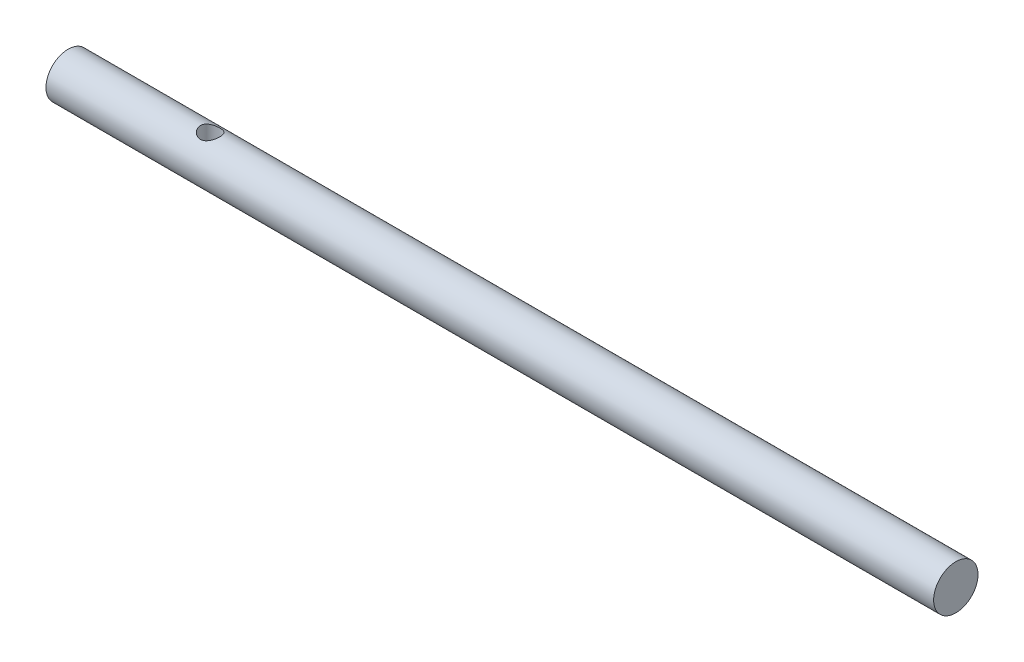
from build123d import *

# Parameters (mm, degrees)
SKETCH3_R           = 2.5
BOSS_EXTRUDE1_DEPTH = 50
CUT_EXTRUDE1_REACH  = 52.312
SKETCH4_R           = 1.1


with BuildPart() as part:
    # Sketch3 → Boss-Extrude1 (new, symmetric)
    with BuildSketch(Plane(origin=(0, 0, 0), x_dir=(0, 0, -1), z_dir=(1, 0, 0))):
        Circle(SKETCH3_R)
    extrude(amount=BOSS_EXTRUDE1_DEPTH, both=True)

    # Sketch4 → Cut-Extrude1 (cut, up to next)
    with BuildSketch(Plane(origin=(0, 2.5, 0), x_dir=(1, 0, 0), z_dir=(0, 1, 0)), mode=Mode.PRIVATE) as cut_extrude1_sk1:
        with Locations(Location((-34, 0, 0), (0, 0, 270))):
            Circle(SKETCH4_R)
    cut_extrude1_tool1 = extrude(cut_extrude1_sk1.sketch, amount=-CUT_EXTRUDE1_REACH, mode=Mode.PRIVATE) & part.part
    add(cut_extrude1_tool1.solids().sort_by_distance((-34, 2.5, 0))[0], mode=Mode.SUBTRACT)


solid = part.part
